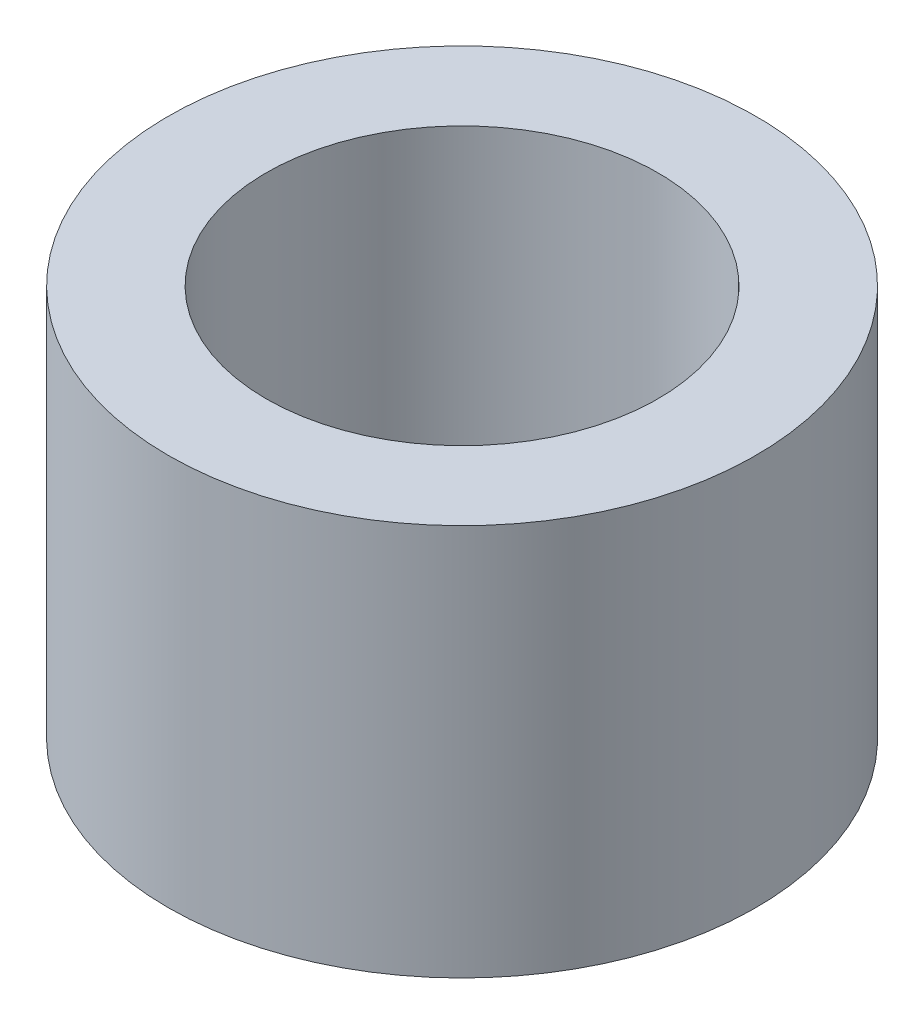
from build123d import *

# Parameters (mm, degrees)
SKETCH1_R           = 4.7625
BOSS_EXTRUDE1_DEPTH = 6.35
SKETCH2_R           = 3.175
CUT_EXTRUDE1_DEPTH  = 6.35


with BuildPart() as part:
    # Sketch1 → Boss-Extrude1 (new body)
    with BuildSketch(Plane(origin=(0, 0, 0), x_dir=(1, 0, 0), z_dir=(0, 1, 0))):
        with Locations(Location((0, 0, 0), (0, 0, 270))):
            Circle(SKETCH1_R)
    extrude(amount=BOSS_EXTRUDE1_DEPTH)

    # Sketch2 → Cut-Extrude1 (cut)
    with BuildSketch(Plane(origin=(0, 6.35, 0), x_dir=(1, 0, 0), z_dir=(0, 1, 0))):
        with Locations(Location((0, 0, 0), (0, 0, 270))):
            Circle(SKETCH2_R)
    extrude(amount=-CUT_EXTRUDE1_DEPTH, mode=Mode.SUBTRACT)


solid = part.part
